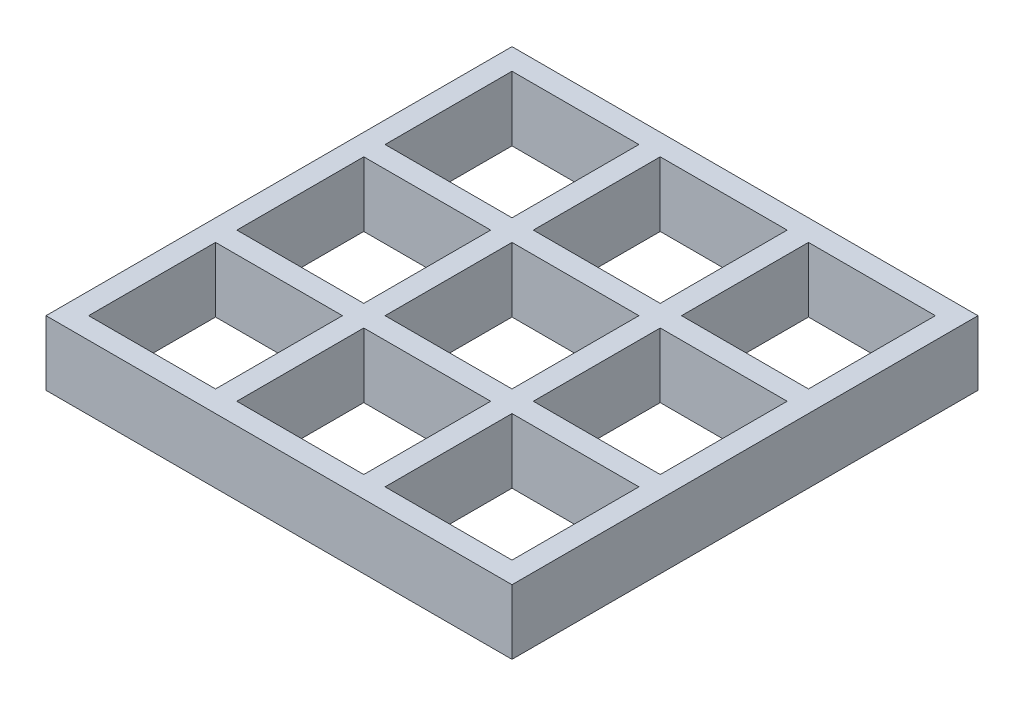
from build123d import *

# Parameters (mm, degrees)
SKETCH1_W           = 19.46
SKETCH1_H           = 19.46
SKETCH1_W_2         = 5.3
SKETCH1_H_2         = 5.3
BOSS_EXTRUDE1_DEPTH = 2.7


with BuildPart() as part:
    # Sketch1 → Boss-Extrude1 (new body)
    with BuildSketch(Plane(origin=(0, 0, 0), x_dir=(1, 0, 0), z_dir=(0, 1, 0))):
        with Locations((6.19, 6.19)):
            Rectangle(SKETCH1_W, SKETCH1_H)
        with Locations((6.19, 0)):
            Rectangle(SKETCH1_W_2, SKETCH1_H_2, mode=Mode.SUBTRACT)
        Rectangle(SKETCH1_W_2, SKETCH1_H_2, mode=Mode.SUBTRACT)
        with Locations((12.38, 0)):
            Rectangle(SKETCH1_W_2, SKETCH1_H_2, mode=Mode.SUBTRACT)
        with Locations((6.19, 6.19)):
            Rectangle(SKETCH1_W_2, SKETCH1_H_2, mode=Mode.SUBTRACT)
        with Locations((12.38, 6.19)):
            Rectangle(SKETCH1_W_2, SKETCH1_H_2, mode=Mode.SUBTRACT)
        with Locations((6.19, 12.38)):
            Rectangle(SKETCH1_W_2, SKETCH1_H_2, mode=Mode.SUBTRACT)
        with Locations((12.38, 12.38)):
            Rectangle(SKETCH1_W_2, SKETCH1_H_2, mode=Mode.SUBTRACT)
        with Locations((0, 6.19)):
            Rectangle(SKETCH1_W_2, SKETCH1_H_2, mode=Mode.SUBTRACT)
        with Locations((0, 12.38)):
            Rectangle(SKETCH1_W_2, SKETCH1_H_2, mode=Mode.SUBTRACT)
    extrude(amount=BOSS_EXTRUDE1_DEPTH)


solid = part.part
